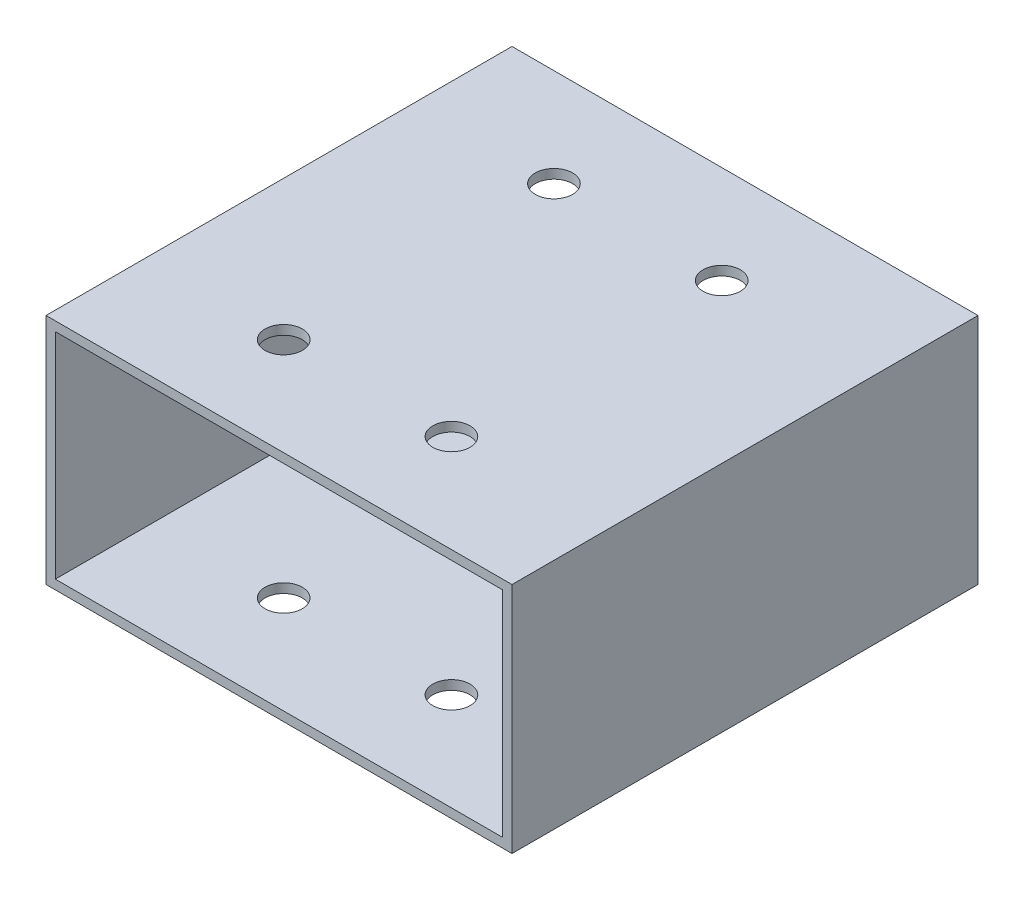
from build123d import *

# Parameters (mm, degrees)
SKETCH_1_W          = 50
SKETCH_1_H          = 25
SKETCH_1_W_2        = 48
SKETCH_1_H_2        = 23
EXTRUDE_1_DEPTH     = 50
SKETCH_2_R          = 2
CUT_EXTRUDE_1_DEPTH = 50


with BuildPart() as part:
    # 草图1 → 凸台-拉伸1 (new body)
    with BuildSketch(Plane.XY):
        with Locations((25, 12.5)):
            Rectangle(SKETCH_1_W, SKETCH_1_H)
        with Locations((25, 12.5)):
            Rectangle(SKETCH_1_W_2, SKETCH_1_H_2, mode=Mode.SUBTRACT)
    extrude(amount=EXTRUDE_1_DEPTH)

    # 草图2 → 切除-拉伸1 (cut)
    with BuildSketch(Plane(origin=(0, 25, 0), x_dir=(1, 0, 0), z_dir=(0, 1, 0))):
        with Locations(Location((15, -10.5, 0), (0, 0, 270))):
            Circle(SKETCH_2_R)
        with Locations(Location((33, -10.5, 0), (0, 0, 270))):
            Circle(SKETCH_2_R)
        with Locations(Location((33, -39.5, 0), (0, 0, 270))):
            Circle(SKETCH_2_R)
        with Locations(Location((15, -39.5, 0), (0, 0, 270))):
            Circle(SKETCH_2_R)
    extrude(amount=-CUT_EXTRUDE_1_DEPTH, mode=Mode.SUBTRACT)


solid = part.part
